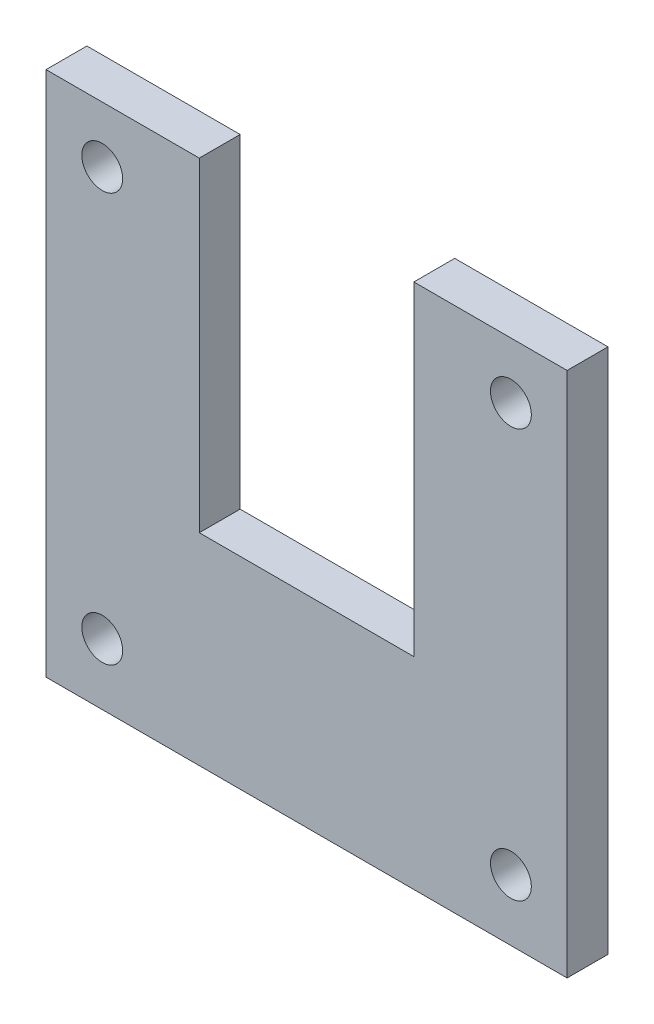
from build123d import *

# Parameters (mm, degrees)
SKETCH_1_R          = 2
EXTRUDE_1_DEPTH     = 4
SKETCH_2_W          = 21
SKETCH_2_H          = 31.756996305
CUT_EXTRUDE_1_DEPTH = 4


with BuildPart() as part:
    # 草图1 → 凸台-拉伸1 (new body)
    with BuildSketch(Plane.XY):
        Polygon((-24.223404255, 19.554868645), (-24.223404255, -31.445131355), (-24.223404255, -31.945131355), (26.776595745, -31.945131355), (26.776595745, -31.445131355), (26.776595745, 19.554868645), align=None)
        with Locations((-18.723404255, -25.945131355)):
            Circle(SKETCH_1_R, mode=Mode.SUBTRACT)
        with Locations((21.276595745, -25.945131355)):
            Circle(SKETCH_1_R, mode=Mode.SUBTRACT)
        with Locations((-18.723404255, 14.054868645)):
            Circle(SKETCH_1_R, mode=Mode.SUBTRACT)
        with Locations((21.276595745, 14.054868645)):
            Circle(SKETCH_1_R, mode=Mode.SUBTRACT)
    extrude(amount=EXTRUDE_1_DEPTH)

    # 草图2 → 切除-拉伸1 (cut)
    with BuildSketch(Plane.XY.offset(4)):
        with Locations((1.276595745, 3.676370493)):
            Rectangle(SKETCH_2_W, SKETCH_2_H)
    extrude(amount=-CUT_EXTRUDE_1_DEPTH, mode=Mode.SUBTRACT)


solid = part.part
